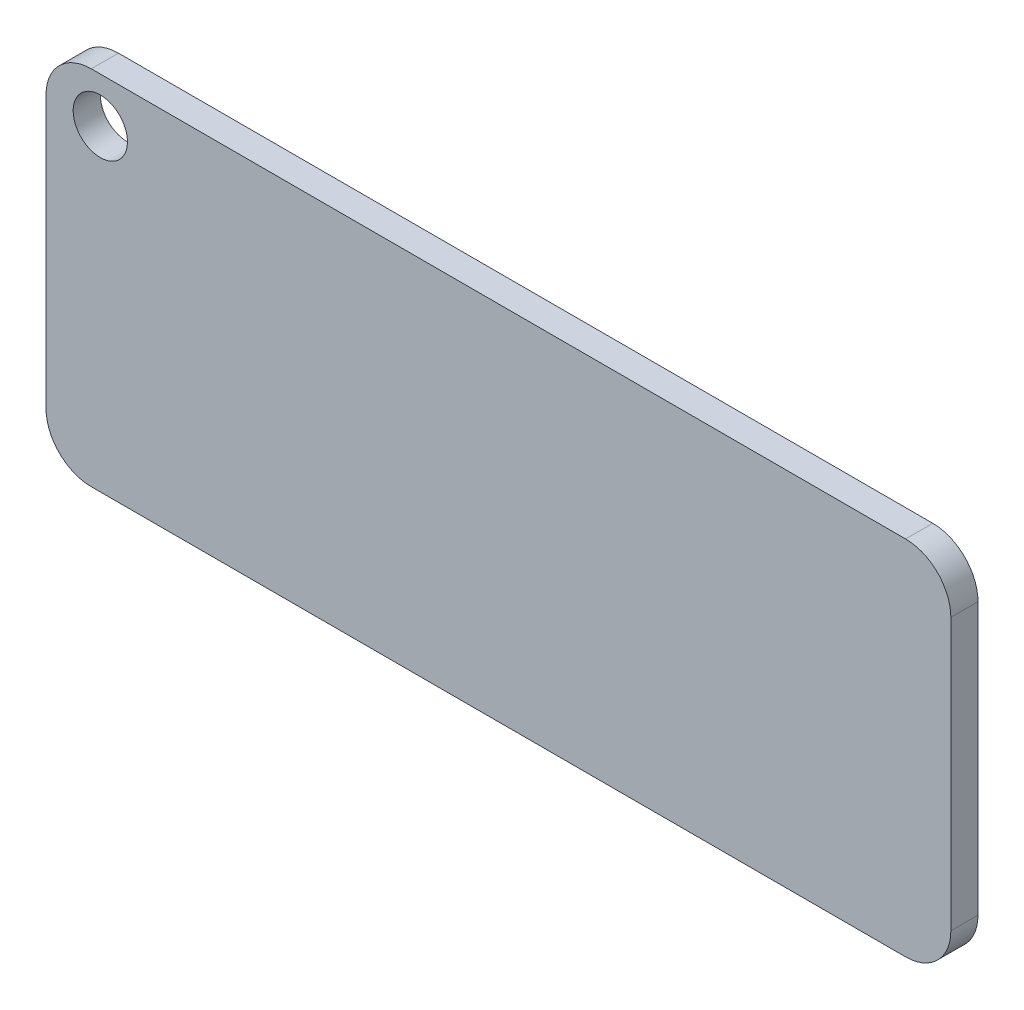
from build123d import *

# Parameters (mm, degrees)
BOSS_EXTRUDE1_DEPTH = 1.5
BOSS_EXTRUDE2_DEPTH = 2
SKETCH3_R           = 1.5
CUT_EXTRUDE2_DEPTH  = 2


with BuildPart() as part:
    # Sketch1 → Boss-Extrude1 (new body)
    with BuildSketch(Plane.XY):
        with BuildLine():
            Line((-22.5, -10), (22.5, -10))
            ThreePointArc((22.5, -10), (24.267766953, -9.267766953), (25, -7.5))
            Line((25, -7.5), (25, 7.5))
            ThreePointArc((25, 7.5), (24.267766953, 9.267766953), (22.5, 10))
            Line((22.5, 10), (-22.5, 10))
            ThreePointArc((-22.5, 10), (-24.267766953, 9.267766953), (-25, 7.5))
            Line((-25, 7.5), (-25, -7.5))
            ThreePointArc((-25, -7.5), (-24.267766953, -9.267766953), (-22.5, -10))
        make_face()
    extrude(amount=BOSS_EXTRUDE1_DEPTH)

    # Sketch2 → Boss-Extrude2 (add)
    # profile 1 of 6: a face of its own
    with BuildSketch(Plane(origin=(0, 0, 0), x_dir=(-1, 0, 0), z_dir=(0, 0, -1))):
        Polygon((-14.053465789, 2.414208254), (-10.435320506, 2.414208254), (-10.589554781, 1.752749921), (-12.887168463, 1.752749921), (-13.120904941, 0.836884536), (-10.803415709, 0.836884536), (-10.957649983, 0.175426203), (-13.289449613, 0.175426203), (-13.730686842, -1.554541746), (-15.06552884, -1.554541746), align=None)
    # profile 2 of 6: a face of its own
    with BuildSketch(Plane(origin=(0, 0, 0), x_dir=(-1, 0, 0), z_dir=(0, 0, -1))):
        with BuildLine():
            add(Edge.make_bspline(
                [(-9.341370186, -0.689557771), (-9.285865926, -0.690811866), (-9.178204449, -0.693244431), (-9.023036219, -0.719787648), (-8.879228774, -0.760027054), (-8.770345257, -0.809930768), (-8.69214949, -0.855438952), (-8.641423289, -0.891441353), (-8.598268944, -0.929124036), (-8.563569197, -0.969538178), (-8.536218662, -1.011177311), (-8.515446806, -1.054486679), (-8.50436249, -1.10056673), (-8.502674577, -1.131803531), (-8.501826916, -1.147490464)],
                knots=[0, 0, 0, 0, 1.915008275, 3.714536824, 5.420516977, 7.058871763, 7.834278453, 8.542854041, 9.204100056, 9.807662933, 10.376282066, 10.920898547, 11.458081756, 12, 12, 12, 12], degree=3))
            add(Edge.make_bspline(
                [(-8.501826916, -1.147490464), (-8.502666594, -1.162916593), (-8.504338858, -1.193638576), (-8.515608823, -1.239125829), (-8.536204738, -1.282216256), (-8.56357188, -1.32385426), (-8.598273779, -1.36425671), (-8.641397776, -1.401993744), (-8.692368628, -1.437844967), (-8.769926874, -1.484715239), (-8.879488152, -1.533674627), (-9.022764144, -1.575812727), (-9.178346956, -1.600371807), (-9.2858957, -1.603704254), (-9.341370186, -1.605423156)],
                knots=[0, 0, 0, 0, 0.53332143, 1.062138843, 1.607289092, 2.176465516, 2.780619933, 3.442514021, 4.151784069, 4.932640264, 6.572600768, 8.282831248, 10.082655194, 12, 12, 12, 12], degree=3))
            add(Edge.make_bspline(
                [(-9.341370186, -1.605423156), (-9.397638853, -1.603721901), (-9.506243611, -1.600438291), (-9.66291339, -1.575912158), (-9.806184938, -1.533751019), (-9.915385592, -1.484969875), (-9.992047465, -1.437572368), (-10.042924416, -1.402290129), (-10.085298201, -1.363986719), (-10.119916046, -1.323851545), (-10.147521915, -1.282417734), (-10.166934317, -1.238918094), (-10.17845746, -1.193663731), (-10.180092479, -1.162925002), (-10.180913455, -1.147490464)],
                knots=[0, 0, 0, 0, 1.943216976, 3.750623923, 5.459470211, 7.089772721, 7.862171547, 8.57086754, 9.225412532, 9.829077971, 10.397793727, 10.938720809, 11.467110218, 12, 12, 12, 12], degree=3))
            add(Edge.make_bspline(
                [(-10.180913455, -1.147490464), (-10.180084966, -1.131794908), (-10.178435226, -1.100540936), (-10.167091694, -1.054696401), (-10.147507492, -1.01097607), (-10.11991886, -0.969540836), (-10.085303089, -0.929394039), (-10.042898736, -0.891144684), (-9.992269849, -0.855711437), (-9.914963115, -0.809673143), (-9.806445386, -0.759953003), (-9.662640869, -0.719687931), (-9.506386499, -0.693174843), (-9.397669016, -0.690791812), (-9.341370186, -0.689557771)],
                knots=[0, 0, 0, 0, 0.541482258, 1.07823329, 1.618633356, 2.18679502, 2.789872317, 3.443779596, 4.151785117, 4.918702504, 6.547416636, 8.252024287, 10.059128646, 12, 12, 12, 12], degree=3))
        make_face()
    # profile 3 of 6: a face of its own
    with BuildSketch(Plane(origin=(0, 0, 0), x_dir=(-1, 0, 0), z_dir=(0, 0, -1))):
        with BuildLine():
            Line((3.133320569, 1.690738202), (1.967023244, 1.294817229))
            add(Edge.make_bspline(
                [(1.967023244, 1.294817229), (1.924545729, 1.320320688), (1.840684779, 1.370670724), (1.713109268, 1.439622792), (1.586872598, 1.50317476), (1.462166778, 1.561371117), (1.338492471, 1.613579657), (1.215395022, 1.658379148), (1.093882087, 1.69859214), (0.931331421, 1.743366691), (0.721559086, 1.789311141), (0.457405365, 1.826636307), (0.177323773, 1.850097129), (-0.014918234, 1.853015467), (-0.113549423, 1.854512741)],
                knots=[0, 0, 0, 0, 0.815953397, 1.610890574, 2.387792251, 3.143524485, 3.877152395, 4.597995978, 5.300569768, 5.984678294, 7.374207828, 8.834076309, 10.375699349, 12, 12, 12, 12], degree=3))
            add(Edge.make_bspline(
                [(-0.113549423, 1.854512741), (-0.220412659, 1.853012735), (-0.429461211, 1.850078384), (-0.735252628, 1.821921324), (-1.026284896, 1.779248933), (-1.3019948, 1.717438519), (-1.56225567, 1.637054374), (-1.807091994, 1.538965929), (-2.037809178, 1.424574369), (-2.180080678, 1.332489949), (-2.250568653, 1.286867008)],
                knots=[0, 0, 0, 0, 1.142257694, 2.234513254, 3.280354053, 4.285288296, 5.25226812, 6.189317145, 7.102902771, 8, 8, 8, 8], degree=3))
            add(Edge.make_bspline(
                [(-2.250568653, 1.286867008), (-2.302421879, 1.249609511), (-2.402326066, 1.177826512), (-2.535622159, 1.059285935), (-2.649450657, 0.938932874), (-2.742421586, 0.81449621), (-2.814460962, 0.686710099), (-2.867557248, 0.555852461), (-2.89860186, 0.420945422), (-2.902784857, 0.329811623), (-2.904871788, 0.284344222)],
                knots=[0, 0, 0, 0, 1.228769864, 2.367437213, 3.428878879, 4.413741964, 5.350500526, 6.245959666, 7.124894863, 8, 8, 8, 8], degree=3))
            add(Edge.make_bspline(
                [(-2.904871788, 0.284344222), (-2.90298187, 0.239890599), (-2.899220207, 0.151410807), (-2.865857819, 0.022228645), (-2.812659822, -0.101527009), (-2.737327579, -0.218713308), (-2.642397641, -0.331442951), (-2.524914411, -0.436766068), (-2.387257757, -0.537020761), (-2.230422808, -0.630399896), (-2.058859177, -0.716198918), (-1.875430724, -0.791003701), (-1.682381439, -0.853615117), (-1.479760059, -0.905280828), (-1.26738362, -0.945870085), (-1.045115273, -0.973841756), (-0.81347353, -0.992040855), (-0.655789982, -0.993899391), (-0.575457225, -0.994846233)],
                knots=[0, 0, 0, 0, 0.733105661, 1.459162002, 2.188429833, 2.949734211, 3.751072941, 4.615440301, 5.548593466, 6.559629128, 7.62634736, 8.713792762, 9.827939711, 10.975422395, 12.165104834, 13.396303139, 14.673532205, 16, 16, 16, 16], degree=3))
            add(Edge.make_bspline(
                [(-0.575457225, -0.994846233), (-0.515022829, -0.994251194), (-0.395667579, -0.993076018), (-0.218779618, -0.983258387), (-0.045873429, -0.9674045), (0.122852245, -0.945410597), (0.287530739, -0.916557501), (0.448036924, -0.88170476), (0.604589731, -0.840470624), (0.75639978, -0.792888411), (0.902710886, -0.739005581), (1.042835993, -0.678490392), (1.176392602, -0.612144223), (1.302558401, -0.538468706), (1.422102103, -0.4589162), (1.535060017, -0.37303465), (1.64145261, -0.28098407), (1.706454269, -0.214086343), (1.73885192, -0.180743669)],
                knots=[0, 0, 0, 0, 1.150248182, 2.271689113, 3.370913604, 4.454565641, 5.509412839, 6.552227535, 7.57996442, 8.589819741, 9.579300642, 10.546309323, 11.49375468, 12.415997071, 13.325348104, 14.225248739, 15.115441486, 16, 16, 16, 16], degree=3))
            Line((1.73885192, -0.180743669), (-0.582612423, -0.180743669))
            Line((-0.582612423, -0.180743669), (-0.411682686, 0.480714664))
            Line((-0.411682686, 0.480714664), (3.353541673, 0.480714664))
            add(Edge.make_bspline(
                [(3.353541673, 0.480714664), (3.349308456, 0.440096012), (3.340941287, 0.359811192), (3.319076674, 0.241338004), (3.289963454, 0.126207177), (3.252192376, 0.014171177), (3.206957497, -0.094435879), (3.154217267, -0.200390655), (3.092990085, -0.302454993), (3.024124706, -0.401734781), (2.947665864, -0.497629369), (2.864339287, -0.591393208), (2.771250176, -0.679880173), (2.672060544, -0.767060181), (2.564405642, -0.850088241), (2.449860359, -0.931146949), (2.326107985, -1.006642089), (2.196259252, -1.080735293), (2.059854696, -1.150398391), (1.918213272, -1.215242954), (1.7726188, -1.276830483), (1.621988945, -1.333369949), (1.466705517, -1.384622759), (1.306798405, -1.431717245), (1.142491342, -1.474754776), (0.973176313, -1.512474777), (0.799644175, -1.546990854), (0.621455701, -1.576362944), (0.438453112, -1.600602077), (0.25113672, -1.621893803), (0.058804958, -1.636031547), (-0.13778219, -1.648807922), (-0.339299992, -1.654660912), (-0.475017198, -1.655752496), (-0.543656344, -1.656304566)],
                knots=[0, 0, 0, 0, 0.8063805, 1.593851845, 2.377154385, 3.150158087, 3.926856882, 4.699346471, 5.485721071, 6.275606832, 7.084091173, 7.906968733, 8.750984134, 9.619099447, 10.514312968, 11.434980433, 12.389315183, 13.376169299, 14.387471746, 15.413299735, 16.452528095, 17.509324775, 18.590204544, 19.681678706, 20.801452839, 21.944331013, 23.107407981, 24.295792457, 25.510581605, 26.753364935, 28.01876028, 29.319254177, 30.644209478, 32, 32, 32, 32], degree=3))
            add(Edge.make_bspline(
                [(-0.543656344, -1.656304566), (-0.618130094, -1.65590755), (-0.765266583, -1.655123173), (-0.982660936, -1.647073873), (-1.194176398, -1.633374556), (-1.39937247, -1.61527571), (-1.598801428, -1.59240666), (-1.792077049, -1.563709012), (-1.979397365, -1.530026225), (-2.160416709, -1.489305865), (-2.335980318, -1.446903198), (-2.504798174, -1.395918364), (-2.668124342, -1.341466322), (-2.825121478, -1.281155506), (-2.976307176, -1.215619675), (-3.121205877, -1.145204869), (-3.260483508, -1.069720487), (-3.349029769, -1.014384356), (-3.393015318, -0.986896013)],
                knots=[0, 0, 0, 0, 1.205057685, 2.38081144, 3.519524871, 4.634543788, 5.71378675, 6.767196693, 7.795877329, 8.792636482, 9.769239687, 10.717633949, 11.645178387, 12.55464444, 13.438110839, 14.310739319, 15.160856058, 16, 16, 16, 16], degree=3))
            add(Edge.make_bspline(
                [(-3.393015318, -0.986896013), (-3.426828618, -0.964336092), (-3.493139618, -0.920094009), (-3.588276044, -0.85090647), (-3.676114597, -0.779493596), (-3.757988902, -0.706705405), (-3.833120541, -0.632421449), (-3.902123266, -0.556470081), (-3.964276469, -0.478833934), (-4.018753461, -0.39877463), (-4.069054437, -0.318634763), (-4.110622207, -0.23575768), (-4.147032536, -0.151793558), (-4.176307806, -0.065871051), (-4.199428539, 0.021798708), (-4.216250059, 0.110761645), (-4.225972333, 0.201442969), (-4.22717882, 0.262325629), (-4.227788455, 0.293089464)],
                knots=[0, 0, 0, 0, 1.220941325, 2.394378494, 3.531923217, 4.620042555, 5.683898593, 6.703968129, 7.701010851, 8.66814756, 9.611536649, 10.540713182, 11.450071897, 12.358838117, 13.264391163, 14.171482365, 15.076055224, 16, 16, 16, 16], degree=3))
            add(Edge.make_bspline(
                [(-4.227788455, 0.293089464), (-4.226874883, 0.330500351), (-4.225053998, 0.405065793), (-4.21027776, 0.51575038), (-4.186337951, 0.624523282), (-4.152911839, 0.731235002), (-4.109594817, 0.835934164), (-4.056789474, 0.938717498), (-3.994823116, 1.040070843), (-3.922012575, 1.138371115), (-3.840237774, 1.235049199), (-3.749792593, 1.330439957), (-3.649296372, 1.423492103), (-3.539079373, 1.514090521), (-3.419525223, 1.60337129), (-3.290157842, 1.69039567), (-3.15127679, 1.7754982), (-3.004341614, 1.858699934), (-2.850175855, 1.937301452), (-2.691892421, 2.012062457), (-2.530186761, 2.082550582), (-2.364277205, 2.146591251), (-2.194713252, 2.205327084), (-2.021878561, 2.25951027), (-1.845391615, 2.308937964), (-1.664803266, 2.352659122), (-1.480416098, 2.390530373), (-1.292719041, 2.423886613), (-1.101647217, 2.452830494), (-0.906707662, 2.475478925), (-0.708193706, 2.49408344), (-0.505879242, 2.506355011), (-0.299922937, 2.514862594), (-0.16125968, 2.515599317), (-0.091288806, 2.515971075)],
                knots=[0, 0, 0, 0, 0.70308688, 1.401356342, 2.095186415, 2.794787522, 3.50069282, 4.222590518, 4.965097668, 5.731358925, 6.519778775, 7.344373612, 8.200989202, 9.092739547, 10.025357707, 11.005024761, 12.022667188, 13.086759811, 14.178528712, 15.27497068, 16.377237383, 17.493921893, 18.61728759, 19.750201473, 20.898510466, 22.062128201, 23.242413006, 24.43662064, 25.645658588, 26.874750648, 28.125491228, 29.393407823, 30.684687347, 32, 32, 32, 32], degree=3))
            add(Edge.make_bspline(
                [(-0.091288806, 2.515971075), (0.012624452, 2.515060613), (0.219554753, 2.513247541), (0.52766609, 2.493781706), (0.83225369, 2.465167729), (1.131025674, 2.422679633), (1.420985858, 2.370946859), (1.69837175, 2.309276068), (1.960948951, 2.236789883), (2.211005714, 2.154962223), (2.450766862, 2.059978142), (2.684627834, 1.952808776), (2.912765667, 1.82965579), (3.059620734, 1.737158406), (3.133320569, 1.690738202)],
                knots=[0, 0, 0, 0, 1.108182011, 2.206806369, 3.29159931, 4.370484272, 5.424466979, 6.432509532, 7.400083993, 8.328779095, 9.237349327, 10.149206712, 11.071171565, 12, 12, 12, 12], degree=3))
        make_face()
    # profile 4 of 6: a face of its own
    with BuildSketch(Plane(origin=(0, 0, 0), x_dir=(-1, 0, 0), z_dir=(0, 0, -1))):
        with BuildLine():
            add(Edge.make_bspline(
                [(5.007187507, -0.689557771), (5.062691767, -0.690811866), (5.170353243, -0.693244431), (5.325521473, -0.719787648), (5.469328918, -0.760027054), (5.578212436, -0.809930768), (5.656408202, -0.855438952), (5.707134404, -0.891441353), (5.750288749, -0.929124036), (5.784988495, -0.969538178), (5.81233903, -1.011177311), (5.833110886, -1.054486679), (5.844195202, -1.10056673), (5.845883116, -1.131803531), (5.846730776, -1.147490464)],
                knots=[0, 0, 0, 0, 1.915008275, 3.714536824, 5.420516977, 7.058871763, 7.834278453, 8.542854041, 9.204100056, 9.807662933, 10.376282066, 10.920898547, 11.458081756, 12, 12, 12, 12], degree=3))
            add(Edge.make_bspline(
                [(5.846730776, -1.147490464), (5.845891098, -1.162916593), (5.844218834, -1.193638576), (5.83294887, -1.239125829), (5.812352954, -1.282216256), (5.784985813, -1.32385426), (5.750283913, -1.36425671), (5.707159916, -1.401993744), (5.656189064, -1.437844967), (5.578630819, -1.484715239), (5.46906954, -1.533674627), (5.325793548, -1.575812727), (5.170210736, -1.600371807), (5.062661992, -1.603704254), (5.007187507, -1.605423156)],
                knots=[0, 0, 0, 0, 0.53332143, 1.062138843, 1.607289092, 2.176465516, 2.780619933, 3.442514021, 4.151784069, 4.932640264, 6.572600768, 8.282831248, 10.082655194, 12, 12, 12, 12], degree=3))
            add(Edge.make_bspline(
                [(5.007187507, -1.605423156), (4.950918839, -1.603721901), (4.842314081, -1.600438291), (4.685644302, -1.575912158), (4.542372754, -1.533751019), (4.4331721, -1.484969875), (4.356510227, -1.437572368), (4.305633276, -1.402290129), (4.263259491, -1.363986719), (4.228641646, -1.323851545), (4.201035777, -1.282417734), (4.181623376, -1.238918094), (4.170100233, -1.193663731), (4.168465214, -1.162925002), (4.167644237, -1.147490464)],
                knots=[0, 0, 0, 0, 1.943216976, 3.750623923, 5.459470211, 7.089772721, 7.862171547, 8.57086754, 9.225412532, 9.829077971, 10.397793727, 10.938720809, 11.467110218, 12, 12, 12, 12], degree=3))
            add(Edge.make_bspline(
                [(4.167644237, -1.147490464), (4.168472727, -1.131794908), (4.170122466, -1.100540936), (4.181465999, -1.054696401), (4.2010502, -1.01097607), (4.228638832, -0.969540836), (4.263254604, -0.929394039), (4.305658956, -0.891144684), (4.356287843, -0.855711437), (4.433594577, -0.809673143), (4.542112306, -0.759953003), (4.685916824, -0.719687931), (4.842171193, -0.693174843), (4.950888676, -0.690791812), (5.007187507, -0.689557771)],
                knots=[0, 0, 0, 0, 0.541482258, 1.07823329, 1.618633356, 2.18679502, 2.789872317, 3.443779596, 4.151785117, 4.918702504, 6.547416636, 8.252024287, 10.059128646, 12, 12, 12, 12], degree=3))
        make_face()
    # profile 5 of 6: a face of its own
    with BuildSketch(Plane(origin=(0, 0, 0), x_dir=(-1, 0, 0), z_dir=(0, 0, -1))):
        with BuildLine():
            Line((11.081950878, 2.414208254), (12.376246751, 2.414208254))
            add(Edge.make_bspline(
                [(12.376246751, 2.414208254), (12.470857947, 2.414007453), (12.652943169, 2.413621), (12.915323065, 2.407791536), (13.155994954, 2.399377507), (13.374928597, 2.387486546), (13.5722492, 2.373041628), (13.747709482, 2.35379752), (13.901832418, 2.332823508), (13.996324505, 2.312939018), (14.040227871, 2.303700191)],
                knots=[0, 0, 0, 0, 1.359384902, 2.616222126, 3.770727718, 4.819413074, 5.76650017, 6.612958531, 7.355546148, 8, 8, 8, 8], degree=3))
            add(Edge.make_bspline(
                [(14.040227871, 2.303700191), (14.088836082, 2.292208367), (14.183645583, 2.269793755), (14.320148388, 2.229860917), (14.447748867, 2.186961242), (14.566250325, 2.14118039), (14.675524775, 2.091679482), (14.77613819, 2.039729126), (14.866947298, 1.982868263), (14.949265144, 1.923646363), (15.021688915, 1.860387498), (15.0858508, 1.795687388), (15.139391263, 1.727496369), (15.184078508, 1.657312006), (15.217355722, 1.583171828), (15.242331934, 1.507082392), (15.257114686, 1.427890548), (15.258891897, 1.374380192), (15.259791673, 1.347288683)],
                knots=[0, 0, 0, 0, 1.434754571, 2.79846473, 4.084112867, 5.301421551, 6.446293497, 7.52921563, 8.551707761, 9.521749882, 10.43921812, 11.311407778, 12.135413887, 12.925483776, 13.695452672, 14.463499516, 15.222092298, 16, 16, 16, 16], degree=3))
            add(Edge.make_bspline(
                [(15.259791673, 1.347288683), (15.258788895, 1.31751969), (15.256783696, 1.257992343), (15.238454205, 1.170353506), (15.209601302, 1.084805034), (15.168430822, 1.001602523), (15.11559319, 0.920477072), (15.051450369, 0.84156454), (14.976211611, 0.764821039), (14.889434517, 0.691662399), (14.793871749, 0.621035525), (14.689122867, 0.555932983), (14.576931852, 0.495711848), (14.457082087, 0.439651754), (14.329177063, 0.389348342), (14.193571656, 0.342652589), (14.049712411, 0.302948053), (13.924156384, 0.272612706), (13.817510062, 0.251973008), (13.730332547, 0.236699691), (13.636730337, 0.22264252), (13.536611295, 0.208813579), (13.429668945, 0.19751541), (13.316612073, 0.185053868), (13.19701378, 0.175199759), (13.071179062, 0.165188937), (12.938588984, 0.157981087), (12.79978584, 0.149402644), (12.654521266, 0.143435771), (12.502938257, 0.137803446), (12.344723711, 0.133064321), (12.179885827, 0.12916341), (12.00869417, 0.125719755), (11.892345055, 0.124940571), (11.833246701, 0.124544793)],
                knots=[0, 0, 0, 0, 0.724714069, 1.449169122, 2.172125817, 2.920174394, 3.704768912, 4.526771154, 5.394461476, 6.319791312, 7.289834093, 8.287912624, 9.322351963, 10.391351144, 11.51023687, 12.670245434, 13.88466988, 15.14564645, 15.816912029, 16.531454881, 17.302321152, 18.123409607, 18.994194677, 19.922764032, 20.895104301, 21.918416499, 22.998844378, 24.130848574, 25.30735047, 26.541668086, 27.827406085, 29.164614474, 30.559794651, 32, 32, 32, 32], degree=3))
            Line((11.833246701, 0.124544793), (11.404729824, -1.554541746))
            Line((11.404729824, -1.554541746), (10.069887827, -1.554541746))
            Line((10.069887827, -1.554541746), (11.081950878, 2.414208254))
        make_face()
        with BuildLine():
            add(Edge.make_bspline(
                [(12.001791373, 0.786003126), (12.050819611, 0.786104683), (12.146497025, 0.78630287), (12.286937268, 0.789335497), (12.420788606, 0.791143654), (12.548278734, 0.795042859), (12.669076217, 0.801167572), (12.78336379, 0.806041281), (12.891196038, 0.813565479), (12.992442839, 0.821385108), (13.08738374, 0.829875045), (13.175352628, 0.840288775), (13.256964443, 0.851560797), (13.332127965, 0.86294712), (13.400707721, 0.876729238), (13.462795345, 0.890869137), (13.518513351, 0.90591035), (13.582885928, 0.926342259), (13.653189994, 0.956443229), (13.729015351, 0.994735472), (13.793023017, 1.038445136), (13.84573012, 1.086284591), (13.886383822, 1.138809041), (13.91564206, 1.195556138), (13.933935916, 1.256598041), (13.935890465, 1.298933034), (13.936875007, 1.320257934)],
                knots=[0, 0, 0, 0, 1.635600671, 3.191834878, 4.686191758, 6.101435177, 7.446684688, 8.72128559, 9.917463935, 11.05255449, 12.109113411, 13.097166833, 14.007398917, 14.857694794, 15.632729486, 16.34044784, 16.98170667, 17.557659471, 18.59205127, 19.52923426, 20.387535789, 21.169598142, 21.894610403, 22.590523343, 23.290021176, 24, 24, 24, 24], degree=3))
            add(Edge.make_bspline(
                [(13.936875007, 1.320257934), (13.935257556, 1.34409438), (13.932022353, 1.391771717), (13.903417529, 1.459699518), (13.855576849, 1.519657838), (13.791814384, 1.574153747), (13.709844766, 1.620672698), (13.611150228, 1.660152178), (13.495017452, 1.691304676), (13.385064047, 1.710566742), (13.281944793, 1.722910226), (13.185374661, 1.730307994), (13.071698448, 1.737690722), (12.940467004, 1.742734719), (12.791807456, 1.747747234), (12.625894665, 1.750741948), (12.442766102, 1.752125207), (12.315030289, 1.752535444), (12.248248204, 1.752749921)],
                knots=[0, 0, 0, 0, 0.609128478, 1.218370561, 1.852838364, 2.560852185, 3.355366384, 4.257229672, 5.278924428, 6.431422373, 7.115541118, 7.940230386, 8.913473512, 10.035236969, 11.306079998, 12.725963394, 14.288287468, 16, 16, 16, 16], degree=3))
            Line((12.248248204, 1.752749921), (12.001791373, 0.786003126))
        make_face(mode=Mode.SUBTRACT)
    # profile 6 of 6: a face of its own
    with BuildSketch(Plane(origin=(0, 0, 0), x_dir=(-1, 0, 0), z_dir=(0, 0, -1))):
        with BuildLine():
            add(Edge.make_bspline(
                [(16.455504814, -0.689557771), (16.511009074, -0.690811866), (16.618670551, -0.693244431), (16.773838781, -0.719787648), (16.917646226, -0.760027054), (17.026529743, -0.809930768), (17.10472551, -0.855438952), (17.155451711, -0.891441353), (17.198606056, -0.929124036), (17.233305803, -0.969538178), (17.260656338, -1.011177311), (17.281428194, -1.054486679), (17.29251251, -1.10056673), (17.294200423, -1.131803531), (17.295048084, -1.147490464)],
                knots=[0, 0, 0, 0, 1.915008275, 3.714536824, 5.420516977, 7.058871763, 7.834278453, 8.542854041, 9.204100056, 9.807662933, 10.376282066, 10.920898547, 11.458081756, 12, 12, 12, 12], degree=3))
            add(Edge.make_bspline(
                [(17.295048084, -1.147490464), (17.294208406, -1.162916593), (17.292536142, -1.193638576), (17.281266177, -1.239125829), (17.260670262, -1.282216256), (17.23330312, -1.32385426), (17.198601221, -1.36425671), (17.155477224, -1.401993744), (17.104506372, -1.437844967), (17.026948126, -1.484715239), (16.917386848, -1.533674627), (16.774110856, -1.575812727), (16.618528044, -1.600371807), (16.5109793, -1.603704254), (16.455504814, -1.605423156)],
                knots=[0, 0, 0, 0, 0.53332143, 1.062138843, 1.607289092, 2.176465516, 2.780619933, 3.442514021, 4.151784069, 4.932640264, 6.572600768, 8.282831248, 10.082655194, 12, 12, 12, 12], degree=3))
            add(Edge.make_bspline(
                [(16.455504814, -1.605423156), (16.399236147, -1.603721901), (16.290631389, -1.600438291), (16.13396161, -1.575912158), (15.990690062, -1.533751019), (15.881489408, -1.484969875), (15.804827535, -1.437572368), (15.753950584, -1.402290129), (15.711576799, -1.363986719), (15.676958954, -1.323851545), (15.649353085, -1.282417734), (15.629940683, -1.238918094), (15.61841754, -1.193663731), (15.616782521, -1.162925002), (15.615961545, -1.147490464)],
                knots=[0, 0, 0, 0, 1.943216976, 3.750623923, 5.459470211, 7.089772721, 7.862171547, 8.57086754, 9.225412532, 9.829077971, 10.397793727, 10.938720809, 11.467110218, 12, 12, 12, 12], degree=3))
            add(Edge.make_bspline(
                [(15.615961545, -1.147490464), (15.616790034, -1.131794908), (15.618439774, -1.100540936), (15.629783306, -1.054696401), (15.649367508, -1.01097607), (15.67695614, -0.969540836), (15.711571911, -0.929394039), (15.753976264, -0.891144684), (15.804605151, -0.855711437), (15.881911885, -0.809673143), (15.990429614, -0.759953003), (16.134234131, -0.719687931), (16.290488501, -0.693174843), (16.399205984, -0.690791812), (16.455504814, -0.689557771)],
                knots=[0, 0, 0, 0, 0.541482258, 1.07823329, 1.618633356, 2.18679502, 2.789872317, 3.443779596, 4.151785117, 4.918702504, 6.547416636, 8.252024287, 10.059128646, 12, 12, 12, 12], degree=3))
        make_face()
    extrude(amount=BOSS_EXTRUDE2_DEPTH)

    # Sketch3 → Cut-Extrude2 (cut)
    with BuildSketch(Plane(origin=(0, 0, 0), x_dir=(-1, 0, 0), z_dir=(0, 0, -1))):
        with Locations((22, 7.5)):
            Circle(SKETCH3_R)
    extrude(amount=-CUT_EXTRUDE2_DEPTH, mode=Mode.SUBTRACT)


solid = part.part
